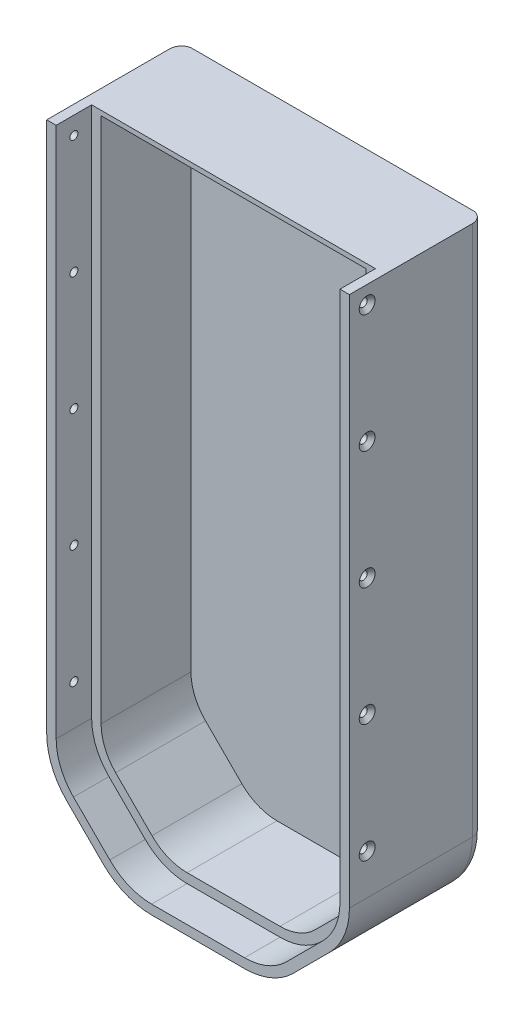
from build123d import *

# Parameters (mm, degrees)
SKETCH1_W                    = 120
SKETCH1_H                    = 265
BOSS_EXTRUDE1_DEPTH          = 42
CHAMFER1_SIZE                = 30
FILLET3_R                    = 25
SHELL1_T                     = -4
FILLET4_R                    = 5
BOSS_EXTRUDE2_DEPTH          = 15
BOSS_EXTRUDE2_DEPTH_BACK     = 42
FILLET7_R                    = 5
SKETCH4_W                    = 128
SKETCH4_H                    = 4
CUT_EXTRUDE1_DEPTH           = 236.172277278
CSK_FOR_M3_SFHCS1_AT_2_COUNT = 2
CSK_FOR_M3_SFHCS1_AT_2_PITCH = 50
CSK_FOR_M3_SFHCS1_AT_3_COUNT = 2
CSK_FOR_M3_SFHCS1_AT_3_PITCH = 100
CSK_FOR_M3_SFHCS1_AT_4_COUNT = 2
CSK_FOR_M3_SFHCS1_AT_4_PITCH = 150
CSK_FOR_M3_SFHCS1_AT_5_COUNT = 2
CSK_FOR_M3_SFHCS1_AT_5_PITCH = 200
SKETCH7_W                    = 112
SKETCH7_H                    = 20.766378669
CUT_EXTRUDE2_DEPTH           = 231.4994577


with BuildPart() as part:
    # Sketch1 → Boss-Extrude1 (new body)
    with BuildSketch(Plane.XY):
        with Locations((0, 82.5)):
            Rectangle(SKETCH1_W, SKETCH1_H)
    extrude(amount=BOSS_EXTRUDE1_DEPTH)

    # Chamfer1
    chamfer1_edges = [part.edges().sort_by_distance(p)[0] for p in [
        (-60, -50, 21),
        (60, -50, 21),
    ]]
    chamfer(chamfer1_edges, length=CHAMFER1_SIZE)

    # Fillet3
    fillet3_edges = [part.edges().sort_by_distance(p)[0] for p in [
        (-60, -20, 21),
        (-30, -50, 21),
        (30, -50, 21),
        (60, -20, 21),
    ]]
    fillet(fillet3_edges, radius=FILLET3_R)

    # Shell1
    shell1_openings = [part.faces().sort_by_distance(p)[0] for p in [
        (0, 86.277211475, 42),
    ]]
    offset(amount=SHELL1_T, openings=shell1_openings, kind=Kind.INTERSECTION)

    # Fillet4
    fillet4_edges = [part.edges().sort_by_distance(p)[0] for p in [
        (56, 211, 23),
        (-56, 211, 23),
    ]]
    fillet(fillet4_edges, radius=FILLET4_R)

    # Sketch2 → Boss-Extrude2 (add, two sides: drawn at the far end of the back side and taken through both)
    with BuildSketch(Plane.XY.offset(42).offset(-BOSS_EXTRUDE2_DEPTH_BACK)):
        with BuildLine():
            Line((-64, 219), (-64, -9.644660941))
            ThreePointArc((-64, -9.644660941), (-61.792506443, -20.742480479), (-55.506096654, -30.150757595))
            Line((-55.506096654, -30.150757595), (-40.150757595, -45.506096654))
            ThreePointArc((-40.150757595, -45.506096654), (-30.742480479, -51.792506443), (-19.644660941, -54))
            Line((-19.644660941, -54), (19.644660941, -54))
            ThreePointArc((19.644660941, -54), (30.742480479, -51.792506443), (40.150757595, -45.506096654))
            Line((40.150757595, -45.506096654), (55.506096654, -30.150757595))
            ThreePointArc((55.506096654, -30.150757595), (61.792506443, -20.742480479), (64, -9.644660941))
            Line((64, -9.644660941), (64, 219))
            Line((64, 219), (-64, 219))
        make_face()
        with BuildLine():
            Line((-60, 215), (-60, -9.644660941))
            ThreePointArc((-60, -9.644660941), (-58.096988313, -19.21174675), (-52.67766953, -27.32233047))
            Line((-52.67766953, -27.32233047), (-37.32233047, -42.67766953))
            ThreePointArc((-37.32233047, -42.67766953), (-29.21174675, -48.096988313), (-19.644660941, -50))
            Line((-19.644660941, -50), (19.644660941, -50))
            ThreePointArc((19.644660941, -50), (29.21174675, -48.096988313), (37.32233047, -42.67766953))
            Line((37.32233047, -42.67766953), (52.67766953, -27.32233047))
            ThreePointArc((52.67766953, -27.32233047), (58.096988313, -19.21174675), (60, -9.644660941))
            Line((60, -9.644660941), (60, 215))
            Line((60, 215), (-60, 215))
        make_face(mode=Mode.SUBTRACT)
    extrude(amount=BOSS_EXTRUDE2_DEPTH + BOSS_EXTRUDE2_DEPTH_BACK)

    # Fillet7
    fillet7_edges = [part.edges().sort_by_distance(p)[0] for p in [
        (64, 104.67766953, 0),
        (61.792506443, -20.742480479, 0),
        (47.828427125, -37.828427125, 0),
        (30.742480479, -51.792506443, 0),
        (0, -54, 0),
        (-30.742480479, -51.792506443, 0),
        (-47.828427125, -37.828427125, 0),
        (-61.792506443, -20.742480479, 0),
        (-64, 104.67766953, 0),
        (0, 219, 0),
    ]]
    fillet(fillet7_edges, radius=FILLET7_R)

    # Sketch4 → Cut-Extrude1 (cut, through all)
    with BuildSketch(Plane.XY.offset(57)):
        with Locations((0, 217)):
            Rectangle(SKETCH4_W, SKETCH4_H)
    extrude(amount=-CUT_EXTRUDE1_DEPTH, mode=Mode.SUBTRACT)

    # Sketch6 → CSK for M3 SFHCS1 (revolve, cut)
    with BuildSketch(Plane(origin=(-64, 7.5, 49.5), x_dir=(0, 0, 1), z_dir=(0, 1, 0))):
        Polygon((0, 0), (0, 16.021463052), (1.7, 15), (1.7, 1.66), (3.36, 0), align=None)
    csk_for_m3_sfhcs1 = revolve(axis=Axis((-70.35, 7.5, 49.5), (1, 0, 0)), mode=Mode.SUBTRACT)

    # CSK for M3 SFHCS1 at 2: CSK for M3 SFHCS1 ×2
    with Locations(*[(0, i * CSK_FOR_M3_SFHCS1_AT_2_PITCH, 0) for i in range(1, CSK_FOR_M3_SFHCS1_AT_2_COUNT)]):
        add(csk_for_m3_sfhcs1, mode=Mode.SUBTRACT)

    # CSK for M3 SFHCS1 at 3: CSK for M3 SFHCS1 ×2
    with Locations(*[(0, i * CSK_FOR_M3_SFHCS1_AT_3_PITCH, 0) for i in range(1, CSK_FOR_M3_SFHCS1_AT_3_COUNT)]):
        add(csk_for_m3_sfhcs1, mode=Mode.SUBTRACT)

    # CSK for M3 SFHCS1 at 4: CSK for M3 SFHCS1 ×2
    with Locations(*[(0, i * CSK_FOR_M3_SFHCS1_AT_4_PITCH, 0) for i in range(1, CSK_FOR_M3_SFHCS1_AT_4_COUNT)]):
        add(csk_for_m3_sfhcs1, mode=Mode.SUBTRACT)

    # CSK for M3 SFHCS1 at 5: CSK for M3 SFHCS1 ×2
    with Locations(*[(0, i * CSK_FOR_M3_SFHCS1_AT_5_PITCH, 0) for i in range(1, CSK_FOR_M3_SFHCS1_AT_5_COUNT)]):
        add(csk_for_m3_sfhcs1, mode=Mode.SUBTRACT)

    # Mirror1: CSK for M3 SFHCS1 across plane
    add(csk_for_m3_sfhcs1.mirror(Plane(origin=(0, 0, 0), x_dir=(0, 0, 1), z_dir=(1, 0, 0))), mode=Mode.SUBTRACT)

    # Mirror1 copy 1 sketch → Mirror1 copy 1 (revolve, cut)
    with BuildSketch(Plane(origin=(64, 57.5, 49.5), x_dir=(0, 0, 1), z_dir=(0, 1, 0))):
        Polygon((0, 0), (0, -16.021463052), (1.7, -15), (1.7, -1.66), (3.36, 0), align=None)
    revolve(axis=Axis((70.35, 57.5, 49.5), (1, 0, 0)), mode=Mode.SUBTRACT)

    # Mirror1 copy 2 sketch → Mirror1 copy 2 (revolve, cut)
    with BuildSketch(Plane(origin=(64, 107.5, 49.5), x_dir=(0, 0, 1), z_dir=(0, 1, 0))):
        Polygon((0, 0), (0, -16.021463052), (1.7, -15), (1.7, -1.66), (3.36, 0), align=None)
    revolve(axis=Axis((70.35, 107.5, 49.5), (1, 0, 0)), mode=Mode.SUBTRACT)

    # Mirror1 copy 3 sketch → Mirror1 copy 3 (revolve, cut)
    with BuildSketch(Plane(origin=(64, 157.5, 49.5), x_dir=(0, 0, 1), z_dir=(0, 1, 0))):
        Polygon((0, 0), (0, -16.021463052), (1.7, -15), (1.7, -1.66), (3.36, 0), align=None)
    revolve(axis=Axis((70.35, 157.5, 49.5), (1, 0, 0)), mode=Mode.SUBTRACT)

    # Mirror1 copy 4 sketch → Mirror1 copy 4 (revolve, cut)
    with BuildSketch(Plane(origin=(64, 207.5, 49.5), x_dir=(0, 0, 1), z_dir=(0, 1, 0))):
        Polygon((0, 0), (0, -16.021463052), (1.7, -15), (1.7, -1.66), (3.36, 0), align=None)
    revolve(axis=Axis((70.35, 207.5, 49.5), (1, 0, 0)), mode=Mode.SUBTRACT)

    # Sketch7 → Cut-Extrude2 (cut, through all)
    with BuildSketch(Plane.XY.offset(4)):
        with Locations((0, 202.616810665)):
            Rectangle(SKETCH7_W, SKETCH7_H)
    extrude(amount=CUT_EXTRUDE2_DEPTH, mode=Mode.SUBTRACT)


solid = part.part
